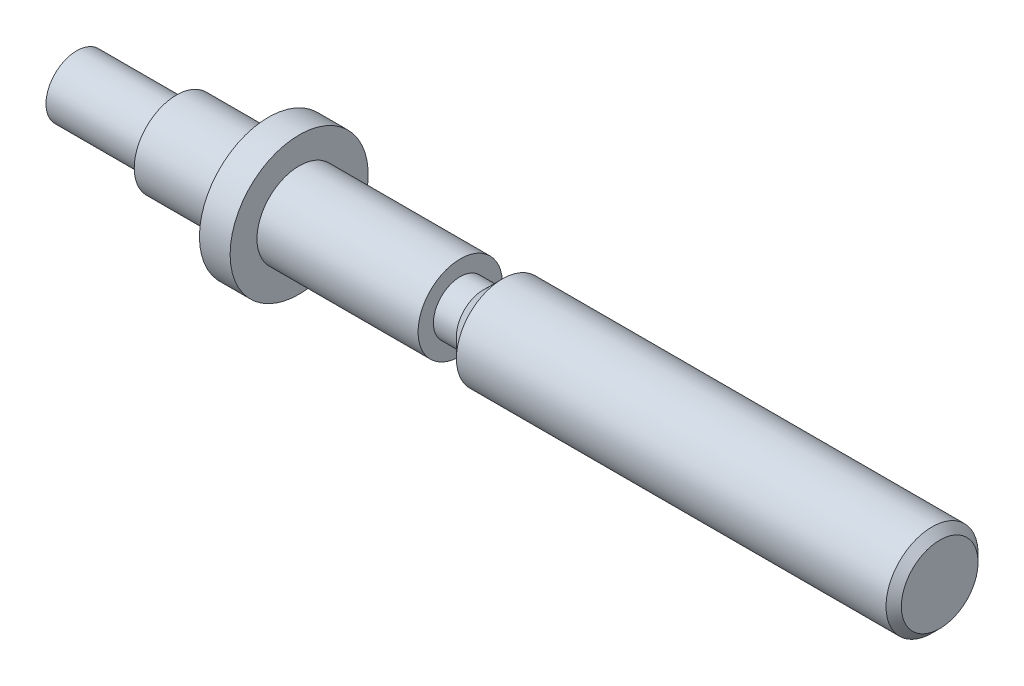
from build123d import *

# Parameters (mm, degrees)
TROU_TARAUD_M42_D     = 3.3
TROU_TARAUD_M42_DEPTH = 11.1
TROU_TARAUD_M42_TIP   = 0.991420021


with BuildPart() as part:
    # Esquisse1 → Révolution1 (revolve)
    with BuildSketch(Plane.XY, mode=Mode.PRIVATE) as r_volution1_sk:
        Polygon((0, 0), (0, 4), (13, 4), (13, 5.5), (25, 5.5), (25, 9), (29, 9), (29, 5.5), (50, 5.5), (50, 3.5), (53, 3.5), (55.5, 6), (111.5, 6), (112.5, 5), (112.5, 0), align=None)
    revolve(r_volution1_sk.sketch.rotate(Axis((-83.694243421, 0, 0), (1, 0, 0)), 90), axis=Axis((-83.694243421, 0, 0), (1, 0, 0)))

    # Trou taraudé M42
    with Locations(Plane.ZY):
        with Locations((0, 0)):
            Hole(TROU_TARAUD_M42_D / 2, depth=TROU_TARAUD_M42_DEPTH)
            with Locations((0, 0, -(TROU_TARAUD_M42_DEPTH + TROU_TARAUD_M42_TIP / 2))):  # 118° drill point
                Cone(0, TROU_TARAUD_M42_D / 2, TROU_TARAUD_M42_TIP, mode=Mode.SUBTRACT)


solid = part.part
